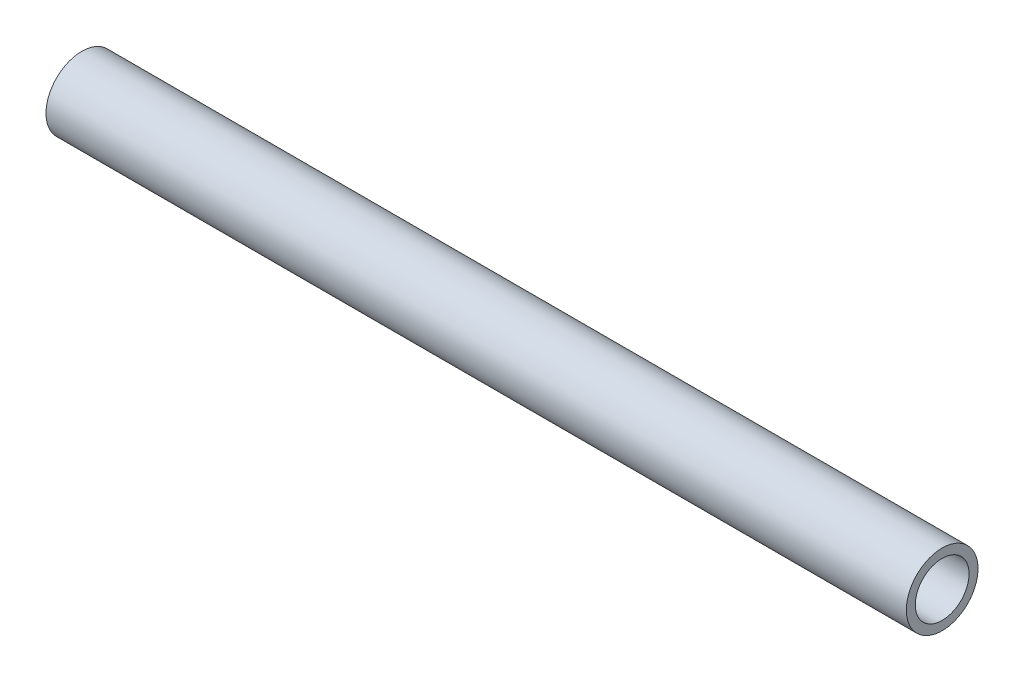
from build123d import *

# Parameters (mm, degrees)
SKETCH1_W = 152.4
SKETCH1_H = 1.5875


with BuildPart() as part:
    # Sketch1 → Revolve1 (revolve)
    with BuildSketch(Plane.XY):
        with Locations((-76.2, 5.55625)):
            Rectangle(SKETCH1_W, SKETCH1_H)
    revolve(axis=Axis((-50.496740772, 0, 0), (-1, 0, 0)))


solid = part.part
